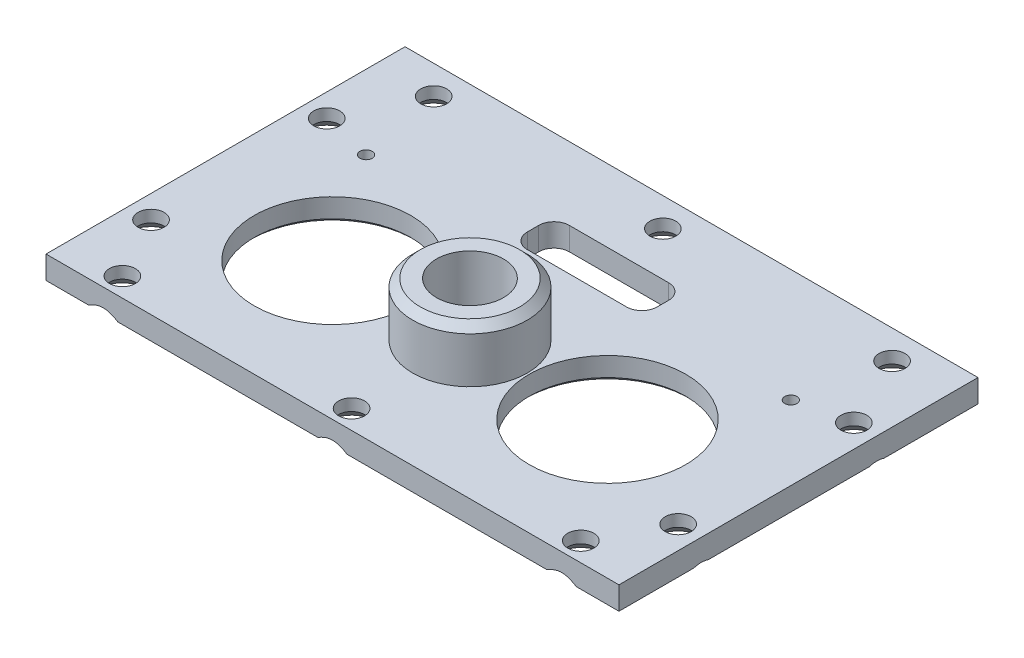
from build123d import *

# Parameters (mm, degrees)
SKETCH_1_W                 = 75
SKETCH_1_H                 = 47
SKETCH_1_R                 = 10.25
SKETCH_1_R_2               = 4.39
EXTRUDE_746_DEPTH          = 3
HOLE_WIZARD_M3_AT_2_COUNT  = 2
HOLE_WIZARD_M3_AT_2_PITCH  = 30
HOLE_WIZARD_M3_AT_3_COUNT  = 2
HOLE_WIZARD_M3_AT_3_PITCH  = 30
HOLE_WIZARD_M3_AT_4_COUNT  = 2
HOLE_WIZARD_M3_AT_4_PITCH  = 40.75
HOLE_WIZARD_M3_AT_5_COUNT  = 2
HOLE_WIZARD_M3_AT_5_PITCH  = 50.602000949
HOLE_WIZARD_M3_AT_6_COUNT  = 2
HOLE_WIZARD_M3_AT_6_PITCH  = 50.602000949
HOLE_WIZARD_M3_AT_7_COUNT  = 2
HOLE_WIZARD_M3_AT_7_PITCH  = 35.472700771
HOLE_WIZARD_M3_AT_8_COUNT  = 2
HOLE_WIZARD_M3_AT_8_PITCH  = 35.472700771
HOLE_WIZARD_M3_AT_9_COUNT  = 2
HOLE_WIZARD_M3_AT_9_PITCH  = 46.549033287
HOLE_WIZARD_M3_AT_10_COUNT = 2
HOLE_WIZARD_M3_AT_10_PITCH = 46.549033287
CHAMFER_1_SIZE             = 0.5
SKETCH_6_W                 = 17
SKETCH_6_H                 = 5.5
CUT_EXTRUDE_1_DEPTH        = 61.201744161
FILLET_1_R                 = 2
HOLE_WIZARD_M21_D          = 1.6
SKETCH_10_R                = 7.5
SKETCH_10_R_2              = 4.39
EXTRUDE_1_DEPTH            = 7
CHAMFER_2_SIZE             = 1


with BuildPart() as part:
    # Эскиз1 → Extrude 746 (new body)
    with BuildSketch(Plane(origin=(0, 0, 0), x_dir=(1, 0, 0), z_dir=(0, 1, 0))):
        with Locations((0, -23.5)):
            Rectangle(SKETCH_1_W, SKETCH_1_H)
        with Locations(Location((18, -29, 0), (0, 0, 270))):
            Circle(SKETCH_1_R, mode=Mode.SUBTRACT)
        with Locations(Location((-18, -29, 0), (0, 0, 270))):
            Circle(SKETCH_1_R, mode=Mode.SUBTRACT)
        with Locations(Location((0, -29, 0), (0, 0, 270))):
            Circle(SKETCH_1_R_2, mode=Mode.SUBTRACT)
    extrude(amount=EXTRUDE_746_DEPTH)

    # Эскиз3 → Крепление стенок M3 (revolve, cut)
    with BuildSketch(Plane(origin=(0, 0, 44.5), x_dir=(0, 0, -1), z_dir=(1, 0, 0))):
        Polygon((0, 0), (0, 3), (1.7, 3), (1.7, 1.45), (3.15, 0), align=None)
    hole_wizard_m3 = revolve(axis=Axis((0, -6.35, 44.5), (0, 1, 0)), mode=Mode.SUBTRACT)

    # Крепление стенок M3 at 2: Крепление стенок M3 ×2
    with Locations(*[(i * HOLE_WIZARD_M3_AT_2_PITCH, 0, 0) for i in range(1, HOLE_WIZARD_M3_AT_2_COUNT)]):
        add(hole_wizard_m3, mode=Mode.SUBTRACT)

    # Крепление стенок M3 at 3: Крепление стенок M3 ×2
    with Locations(*[(-i * HOLE_WIZARD_M3_AT_3_PITCH, 0, 0) for i in range(1, HOLE_WIZARD_M3_AT_3_COUNT)]):
        add(hole_wizard_m3, mode=Mode.SUBTRACT)

    # Крепление стенок M3 at 4: Крепление стенок M3 ×2
    with Locations(*[(0, 0, -i * HOLE_WIZARD_M3_AT_4_PITCH) for i in range(1, HOLE_WIZARD_M3_AT_4_COUNT)]):
        add(hole_wizard_m3, mode=Mode.SUBTRACT)

    # Крепление стенок M3 at 5: Крепление стенок M3 ×2
    with Locations(*[Vector(-0.5928619311020034, 0, -0.8053041230802209) * (i * HOLE_WIZARD_M3_AT_5_PITCH) for i in range(1, HOLE_WIZARD_M3_AT_5_COUNT)]):
        add(hole_wizard_m3, mode=Mode.SUBTRACT)

    # Крепление стенок M3 at 6: Крепление стенок M3 ×2
    with Locations(*[Vector(0.5928619311020034, 0, -0.8053041230802209) * (i * HOLE_WIZARD_M3_AT_6_PITCH) for i in range(1, HOLE_WIZARD_M3_AT_6_COUNT)]):
        add(hole_wizard_m3, mode=Mode.SUBTRACT)

    # Крепление стенок M3 at 7: Крепление стенок M3 ×2
    with Locations(*[Vector(-0.972578891654415, 0, -0.23257321322170757) * (i * HOLE_WIZARD_M3_AT_7_PITCH) for i in range(1, HOLE_WIZARD_M3_AT_7_COUNT)]):
        add(hole_wizard_m3, mode=Mode.SUBTRACT)

    # Крепление стенок M3 at 8: Крепление стенок M3 ×2
    with Locations(*[Vector(0.972578891654415, 0, -0.23257321322170757) * (i * HOLE_WIZARD_M3_AT_8_PITCH) for i in range(1, HOLE_WIZARD_M3_AT_8_COUNT)]):
        add(hole_wizard_m3, mode=Mode.SUBTRACT)

    # Крепление стенок M3 at 9: Крепление стенок M3 ×2
    with Locations(*[Vector(0.7411539523694183, 0, -0.6713351017838932) * (i * HOLE_WIZARD_M3_AT_9_PITCH) for i in range(1, HOLE_WIZARD_M3_AT_9_COUNT)]):
        add(hole_wizard_m3, mode=Mode.SUBTRACT)

    # Крепление стенок M3 at 10: Крепление стенок M3 ×2
    with Locations(*[Vector(-0.7411539523694182, 0, -0.6713351017838932) * (i * HOLE_WIZARD_M3_AT_10_PITCH) for i in range(1, HOLE_WIZARD_M3_AT_10_COUNT)]):
        add(hole_wizard_m3, mode=Mode.SUBTRACT)

    # Фаска1
    chamfer_1_edges = [part.edges().sort_by_distance(p)[0] for p in [
        (0, 0, 24.61),
        (18, 0, 18.75),
        (-18, 0, 18.75),
    ]]
    chamfer(chamfer_1_edges, length=CHAMFER_1_SIZE)

    # Эскиз6 → Вырез-Вытянуть1 (cut, through all)
    with BuildSketch(Plane.XZ):
        with Locations((0, 12.25)):
            Rectangle(SKETCH_6_W, SKETCH_6_H)
    extrude(amount=-CUT_EXTRUDE_1_DEPTH, mode=Mode.SUBTRACT)

    # Скругление1
    fillet_1_edges = [part.edges().sort_by_distance(p)[0] for p in [
        (-8.5, 1.5, 9.5),
        (-8.5, 1.5, 15),
        (8.5, 1.5, 15),
        (8.5, 1.5, 9.5),
    ]]
    fillet(fillet_1_edges, radius=FILLET_1_R)

    # Отверстие обработанное метчиком M21 (through all)
    with Locations(Plane(origin=(0, 0, 0), x_dir=(-1, 0, 0), z_dir=(0, -1, 0))):
        with Locations((27.8, -14.8), (-27.8, -14.8)):
            Hole(HOLE_WIZARD_M21_D / 2)

    # Эскиз10 → Бобышка-Вытянуть1 (add)
    with BuildSketch(Plane(origin=(0, 3, 0), x_dir=(1, 0, 0), z_dir=(0, 1, 0))):
        with Locations(Location((0, -29, 0), (0, 0, 270))):
            Circle(SKETCH_10_R)
        with Locations(Location((0, -29, 0), (0, 0, 270))):
            Circle(SKETCH_10_R_2, mode=Mode.SUBTRACT)
    extrude(amount=EXTRUDE_1_DEPTH)

    # Фаска2
    chamfer_2_edges = [part.edges().sort_by_distance(p)[0] for p in [
        (0, 10, 21.5),
    ]]
    chamfer(chamfer_2_edges, length=CHAMFER_2_SIZE)


solid = part.part
